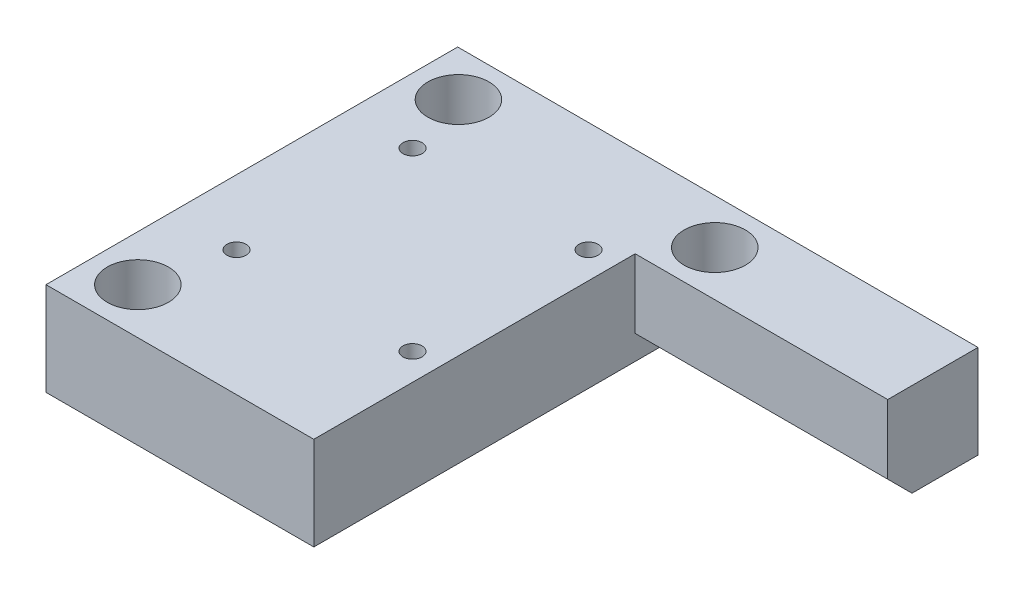
from build123d import *

# Parameters (mm, degrees)
SKETCH1_W                      = 68
SKETCH1_H                      = 53.8
BOSS_EXTRUDE1_DEPTH            = 12.192
SKETCH2_W                      = 33
SKETCH2_H                      = 42
CUT_EXTRUDE1_DEPTH             = 88.56189162
M3X0_5_TAPPED_HOLE1_D          = 2.5
CBORE_FOR_M4_SHCS1_D           = 4.8
CBORE_FOR_M4_SHCS1_CBORE_D     = 8
CBORE_FOR_M4_SHCS1_CBORE_DEPTH = 7
CHAMFER1_SIZE                  = 3.175


with BuildPart() as part:
    # Sketch1 → Boss-Extrude1 (new body)
    with BuildSketch(Plane(origin=(0, 0, 0), x_dir=(1, 0, 0), z_dir=(0, 1, 0))):
        with Locations((34, -26.9)):
            Rectangle(SKETCH1_W, SKETCH1_H)
    extrude(amount=-BOSS_EXTRUDE1_DEPTH)

    # Sketch2 → Cut-Extrude1 (cut, through all)
    with BuildSketch(Plane.XZ.offset(12.192)):
        with Locations((51.5, 32.8)):
            Rectangle(SKETCH2_W, SKETCH2_H)
    extrude(amount=-CUT_EXTRUDE1_DEPTH, mode=Mode.SUBTRACT)

    # M3x0.5 Tapped Hole1 (through all)
    with Locations(Plane(origin=(0, -12.192, 0), x_dir=(-1, 0, 0), z_dir=(0, -1, 0))):
        with Locations((-31.502183488, -14.402425), (-31.5, -37.404608488), (-8.5, -14.400241512), (-8.497816512, -37.402425)):
            Hole(M3X0_5_TAPPED_HOLE1_D / 2)

    # CBORE for M4 SHCS1 (through all)
    with Locations(Plane(origin=(0, 0, 0), x_dir=(1, 0, 0), z_dir=(0, 1, 0))):
        with Locations((6, -47.8), (6, -5.9), (39.5, -5.9)):
            CounterBoreHole(CBORE_FOR_M4_SHCS1_D / 2, CBORE_FOR_M4_SHCS1_CBORE_D / 2, CBORE_FOR_M4_SHCS1_CBORE_DEPTH)

    # Chamfer1
    chamfer1_edges = [part.edges().sort_by_distance(p)[0] for p in [
        (51.5, -12.192, 11.8),
    ]]
    chamfer(chamfer1_edges, length=CHAMFER1_SIZE)


solid = part.part
